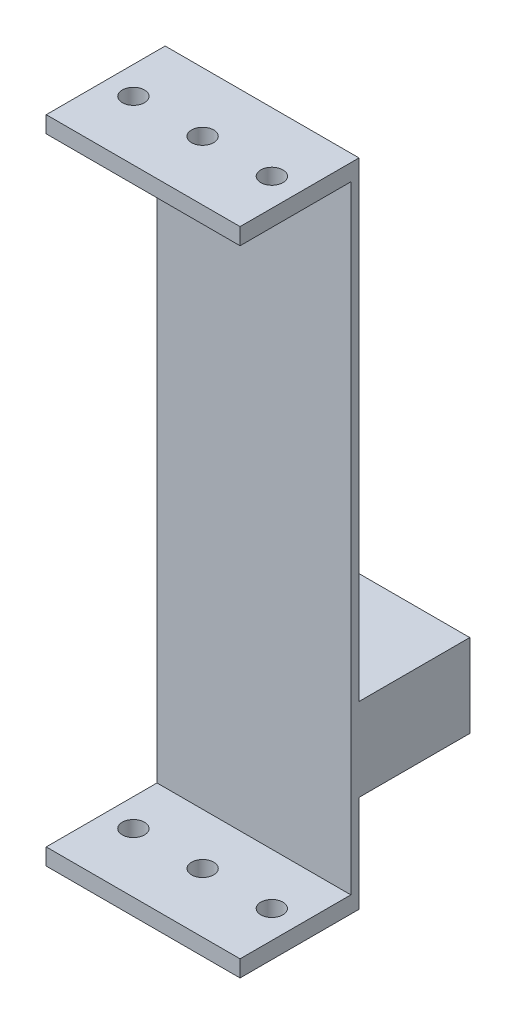
from build123d import *

# Parameters (mm, degrees)
SKETCH_1_W           = 70
SKETCH_1_H           = 40
EXTRUDE_1_DEPTH      = 30
EXTRUDE_3_DEPTH      = 200
EXTRUDE_3_DEPTH_BACK = 35
SKETCH_5_W           = 70
SKETCH_5_H           = 2.954129794
SKETCH_6_W           = 70
SKETCH_6_H           = 6
EXTRUDE_4_DEPTH      = 40
SKETCH_8_R           = 1.75
CUT_EXTRUDE_1_DEPTH  = 6
SKETCH_9_R           = 4
CUT_EXTRUDE_2_DEPTH  = 6


with BuildPart() as part:
    # 草图1 → 凸台-拉伸1 (new body)
    with BuildSketch(Plane(origin=(0, 0, 0), x_dir=(1, 0, 0), z_dir=(0, 1, 0))):
        with Locations((35, 20)):
            Rectangle(SKETCH_1_W, SKETCH_1_H)
    extrude(amount=EXTRUDE_1_DEPTH)

    # 草图5 → 凸台-拉伸3 (add, two sides: drawn at the far end of the back side and taken through both)
    with BuildSketch(Plane(origin=(0, 0, 0), x_dir=(1, 0, 0), z_dir=(0, 1, 0)).offset(-EXTRUDE_3_DEPTH_BACK)):
        with Locations((35, -1.477064897)):
            Rectangle(SKETCH_5_W, SKETCH_5_H)
    extrude(amount=EXTRUDE_3_DEPTH + EXTRUDE_3_DEPTH_BACK)

    # 草图6 → 凸台-拉伸4 (add)
    with BuildSketch(Plane.XY.offset(2.954129794)):
        with Locations((35, -32)):
            Rectangle(SKETCH_6_W, SKETCH_6_H)
    extrude_4 = extrude(amount=EXTRUDE_4_DEPTH)

    # 镜向1: 凸台-拉伸4 across plane
    add(extrude_4.mirror(Plane.ZX.offset(82.5)))

    # 草图8 → 切除-拉伸1 (cut)
    with BuildSketch(Plane.XZ):
        with Locations(Location((60, -5, 0), (0, 0, 270))):
            Circle(SKETCH_8_R)
        with Locations(Location((10, -5, 0), (0, 0, 90))):
            Circle(SKETCH_8_R)
        with Locations(Location((60, -30, 0), (0, 0, 270))):
            Circle(SKETCH_8_R)
        with Locations(Location((10, -30, 0), (0, 0, 90))):
            Circle(SKETCH_8_R)
    extrude(amount=-CUT_EXTRUDE_1_DEPTH, mode=Mode.SUBTRACT)

    # 草图9 → 切除-拉伸2 (cut)
    with BuildSketch(Plane(origin=(0, 200, 0), x_dir=(1, 0, 0), z_dir=(0, 1, 0))):
        with Locations(Location((35, -21.477064897, 0), (0, 0, 270))):
            Circle(SKETCH_9_R)
        with Locations(Location((60, -21.477064897, 0), (0, 0, 270))):
            Circle(SKETCH_9_R)
        with Locations(Location((10, -21.477064897, 0), (0, 0, 90))):
            Circle(SKETCH_9_R)
    cut_extrude_2 = extrude(amount=-CUT_EXTRUDE_2_DEPTH, mode=Mode.SUBTRACT)

    # 镜向2: 切除-拉伸2 across plane
    add(cut_extrude_2.mirror(Plane.ZX.offset(82.5)), mode=Mode.SUBTRACT)


solid = part.part
